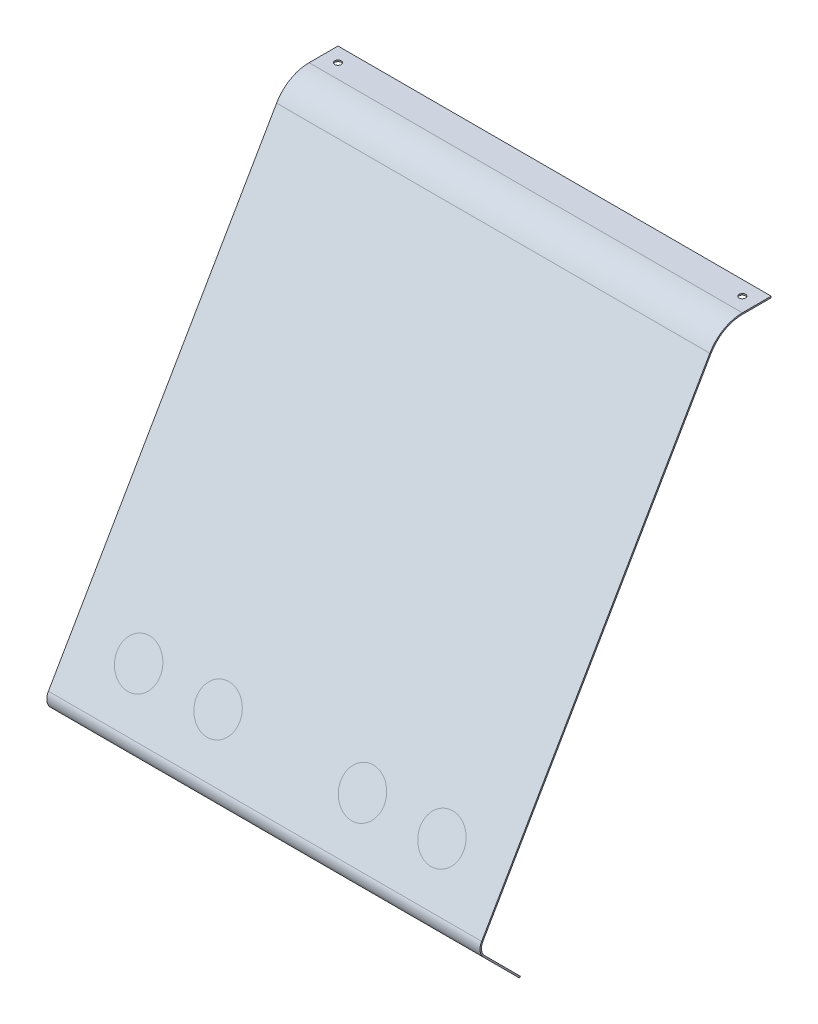
from build123d import *

# Parameters (mm, degrees)
SURFACE_EXTRUDE1_1_DEPTH = 600
THICKEN1_T1              = 2
SKETCH3_R                = 4.5
CUT_EXTRUDE1_DEPTH       = 2
SKETCH4_R                = 4.5
CUT_EXTRUDE2_DEPTH       = 2
LPATTERN1_COUNT          = 2
LPATTERN1_PITCH          = 560


with BuildPart() as body_1:
    # Surface-Extrude1: a surface, the sketch's curves swept straight by 600 mm
    with BuildLine(Plane(origin=(0, 0, 0), x_dir=(0, 0, -1), z_dir=(1, 0, 0)), mode=Mode.PRIVATE) as surface_extrude1_1_path:
        Line((0, 0), (-49.56534309, 49.56534309))
        ThreePointArc((-49.56534309, 49.56534309), (-53.830414293, 58.214051925), (-51.949122429, 67.671944808))
        Line((-51.949122429, 67.671944808), (264.050877571, 615))
        ThreePointArc((264.050877571, 615), (282.35214776, 633.301270189), (307.35214776, 640))
        Line((307.35214776, 640), (347.35214776, 640))
    surface_extrude1_1 = Shell.extrude(surface_extrude1_1_path.wire(), (1 * SURFACE_EXTRUDE1_1_DEPTH, 0 * SURFACE_EXTRUDE1_1_DEPTH, 0 * SURFACE_EXTRUDE1_1_DEPTH))
    add(Solid.thicken(surface_extrude1_1, THICKEN1_T1))

    # Sketch3 → Cut-Extrude1 (cut)
    with BuildSketch(Plane(origin=(0, -1.414213562, 1.414213562), x_dir=(1, 0, 0), z_dir=(0, -0.7071067811865517, 0.7071067811865434))):
        with Locations(Location((580, 33.095980422, 0), (0, 0, 270))):
            Circle(SKETCH3_R)
    cut_extrude1 = extrude(amount=-CUT_EXTRUDE1_DEPTH, mode=Mode.SUBTRACT)

    # Sketch4 → Cut-Extrude2 (cut)
    with BuildSketch(Plane(origin=(0, 642, 0), x_dir=(1, 0, 0), z_dir=(0, 1, 0))):
        with Locations(Location((580, 327.35214776, 0), (0, 0, 270))):
            Circle(SKETCH4_R)
    cut_extrude2 = extrude(amount=-CUT_EXTRUDE2_DEPTH, mode=Mode.SUBTRACT)

    # LPattern1: Cut-Extrude1, Cut-Extrude2 ×2
    with Locations(*[(-i * LPATTERN1_PITCH, 0, 0) for i in range(1, LPATTERN1_COUNT)]):
        add(cut_extrude1, mode=Mode.SUBTRACT)
        add(cut_extrude2, mode=Mode.SUBTRACT)


solid = body_1.part
